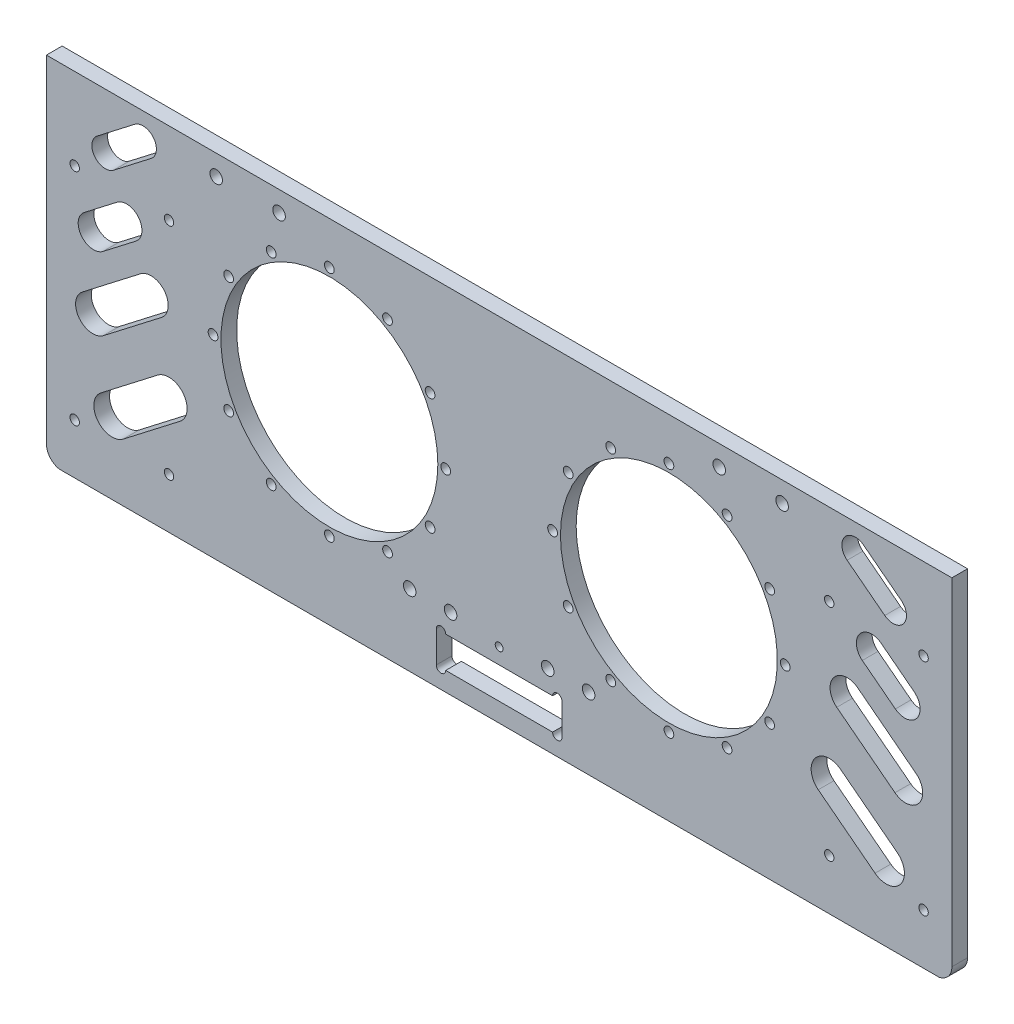
from build123d import *

# Parameters (mm, degrees)
SKETCH_1_W          = 288
SKETCH_1_H          = 101
SKETCH_1_R          = 34.5
SKETCH_1_R_2        = 1.55
EXTRUDE_1_DEPTH     = 2.5
SKETCH_2_R          = 1.5
CUT_EXTRUDE_1_DEPTH = 5
EXTRUDE_2_DEPTH     = 5
CUT_EXTRUDE_2_DEPTH = 5
CUT_EXTRUDE_3_DEPTH = 10
SKETCH_5_R          = 2
CUT_EXTRUDE_4_DEPTH = 10
SKETCH_6_R          = 1.25
CUT_EXTRUDE_5_DEPTH = 10
SKETCH_7_R          = 2
CUT_EXTRUDE_6_DEPTH = 5.5
CUT_EXTRUDE_7_DEPTH = 10
SKETCH_9_R          = 2
CUT_EXTRUDE_8_DEPTH = 10
SKETCH_10_R         = 2
CUT_EXTRUDE_9_DEPTH = 10


with BuildPart() as part:
    # 草图1 → 凸台-拉伸1 (new, symmetric)
    with BuildSketch(Plane.XY):
        Rectangle(SKETCH_1_W, SKETCH_1_H)
        with Locations((-54, 0)):
            Circle(SKETCH_1_R, mode=Mode.SUBTRACT)
        with Locations((-54, 37)):
            Circle(SKETCH_1_R_2, mode=Mode.SUBTRACT)
        with Locations((-35.5, 32.04293994)):
            Circle(SKETCH_1_R_2, mode=Mode.SUBTRACT)
        with Locations((-21.95706006, 18.5)):
            Circle(SKETCH_1_R_2, mode=Mode.SUBTRACT)
        with Locations((-17, 0)):
            Circle(SKETCH_1_R_2, mode=Mode.SUBTRACT)
        with Locations((-21.95706006, -18.5)):
            Circle(SKETCH_1_R_2, mode=Mode.SUBTRACT)
        with Locations((-35.5, -32.04293994)):
            Circle(SKETCH_1_R_2, mode=Mode.SUBTRACT)
        with Locations((-54, -37)):
            Circle(SKETCH_1_R_2, mode=Mode.SUBTRACT)
        with Locations((-72.5, -32.04293994)):
            Circle(SKETCH_1_R_2, mode=Mode.SUBTRACT)
        with Locations((-86.04293994, -18.5)):
            Circle(SKETCH_1_R_2, mode=Mode.SUBTRACT)
        with Locations((-91, 0)):
            Circle(SKETCH_1_R_2, mode=Mode.SUBTRACT)
        with Locations((-86.04293994, 18.5)):
            Circle(SKETCH_1_R_2, mode=Mode.SUBTRACT)
        with Locations((-72.5, 32.04293994)):
            Circle(SKETCH_1_R_2, mode=Mode.SUBTRACT)
        with Locations((72.5, 32.04293994)):
            Circle(SKETCH_1_R_2, mode=Mode.SUBTRACT)
        with Locations((86.04293994, 18.5)):
            Circle(SKETCH_1_R_2, mode=Mode.SUBTRACT)
        with Locations((91, 0)):
            Circle(SKETCH_1_R_2, mode=Mode.SUBTRACT)
        with Locations((86.04293994, -18.5)):
            Circle(SKETCH_1_R_2, mode=Mode.SUBTRACT)
        with Locations((72.5, -32.04293994)):
            Circle(SKETCH_1_R_2, mode=Mode.SUBTRACT)
        with Locations((54, -37)):
            Circle(SKETCH_1_R_2, mode=Mode.SUBTRACT)
        with Locations((35.5, -32.04293994)):
            Circle(SKETCH_1_R_2, mode=Mode.SUBTRACT)
        with Locations((21.95706006, -18.5)):
            Circle(SKETCH_1_R_2, mode=Mode.SUBTRACT)
        with Locations((17, 0)):
            Circle(SKETCH_1_R_2, mode=Mode.SUBTRACT)
        with Locations((21.95706006, 18.5)):
            Circle(SKETCH_1_R_2, mode=Mode.SUBTRACT)
        with Locations((35.5, 32.04293994)):
            Circle(SKETCH_1_R_2, mode=Mode.SUBTRACT)
        with Locations((54, 37)):
            Circle(SKETCH_1_R_2, mode=Mode.SUBTRACT)
        with Locations((54, 0)):
            Circle(SKETCH_1_R, mode=Mode.SUBTRACT)
    extrude(amount=EXTRUDE_1_DEPTH, both=True)

    # 草图2 → 切除-拉伸1 (cut)
    with BuildSketch(Plane.XY.offset(2.5)):
        with Locations((135, -45.5)):
            Circle(SKETCH_2_R)
        with Locations((105, -45.5)):
            Circle(SKETCH_2_R)
        with Locations((135, 24.5)):
            Circle(SKETCH_2_R)
        with Locations((105, 24.5)):
            Circle(SKETCH_2_R)
        with Locations((-105, -45.5)):
            Circle(SKETCH_2_R)
        with Locations((-135, -45.5)):
            Circle(SKETCH_2_R)
        with Locations((-105, 24.5)):
            Circle(SKETCH_2_R)
        with Locations((-135, 24.5)):
            Circle(SKETCH_2_R)
    extrude(amount=-CUT_EXTRUDE_1_DEPTH, mode=Mode.SUBTRACT)

    # 草图3 → 凸台-拉伸2 (add)
    with BuildSketch(Plane.XY.offset(2.5)):
        with BuildLine():
            Line((144, -50.5), (20, -50.5))
            Line((20, -50.5), (20, -55.5))
            ThreePointArc((20, -55.5), (18.5, -57), (17, -55.5))
            Line((17, -55.5), (-17, -55.5))
            ThreePointArc((-17, -55.5), (-18.5, -57), (-20, -55.5))
            Line((-20, -55.5), (-20, -50.5))
            Line((-20, -50.5), (-144, -50.5))
            Line((-144, -50.5), (-144, -56.593800871))
            ThreePointArc((-144, -56.593800871), (-142.857209562, -59.775299636), (-139.951226243, -61.502483855))
            Line((-139.951226243, -61.502483855), (-20.471229939, -84.655844628))
            ThreePointArc((-20.471229939, -84.655844628), (-19.997803382, -84.724280033), (-19.520003695, -84.747161644))
            Line((-19.520003695, -84.747161644), (19.521113953, -84.747161644))
            ThreePointArc((19.521113953, -84.747161644), (19.997818521, -84.724385042), (20.470180004, -84.656262746))
            Line((20.470180004, -84.656262746), (139.949066052, -61.557664392))
            ThreePointArc((139.949066052, -61.557664392), (142.856509449, -59.830910673), (144, -56.64856329))
            Line((144, -56.64856329), (144, -50.5))
        make_face()
    extrude(amount=-EXTRUDE_2_DEPTH)

    # 草图3<3> → 切除-拉伸2 (cut)
    with BuildSketch(Plane.XY.offset(2.5)):
        with BuildLine():
            Line((17, -45.5), (-17, -45.5))
            ThreePointArc((-17, -45.5), (-18.5, -44), (-20, -45.5))
            Line((-20, -45.5), (-20, -50.5))
            Line((-20, -50.5), (20, -50.5))
            Line((20, -50.5), (20, -45.5))
            ThreePointArc((20, -45.5), (18.5, -44), (17, -45.5))
        make_face()
    extrude(amount=-CUT_EXTRUDE_2_DEPTH, mode=Mode.SUBTRACT)

    # 草图4 → 切除-拉伸3 (cut)
    with BuildSketch(Plane.XY.offset(2.5)):
        Polygon((-139.951226243, -61.502483855), (139.949066052, -61.557664392), (30.752560592, -109.96050726), align=None)
    extrude(amount=-CUT_EXTRUDE_3_DEPTH, mode=Mode.SUBTRACT)

    # 草图5 → 切除-拉伸4 (cut)
    with BuildSketch(Plane.XY.offset(2.5)):
        with Locations((28.453320593, -38.713035771)):
            Circle(SKETCH_5_R)
        with Locations((-28.453320593, -38.713035771)):
            Circle(SKETCH_5_R)
    extrude(amount=-CUT_EXTRUDE_4_DEPTH, mode=Mode.SUBTRACT)

    # 草图6 → 切除-拉伸5 (cut)
    with BuildSketch(Plane.XY.offset(2.5)):
        with Locations((0, -40.5)):
            Circle(SKETCH_6_R)
    extrude(amount=-CUT_EXTRUDE_5_DEPTH, mode=Mode.SUBTRACT)

    # 草图7 → 切除-拉伸6 (cut)
    with BuildSketch(Plane.XY.offset(2.5)):
        with Locations((90, 44)):
            Circle(SKETCH_7_R)
        with Locations((70, 44)):
            Circle(SKETCH_7_R)
    extrude(amount=-CUT_EXTRUDE_6_DEPTH, mode=Mode.SUBTRACT)

    # 草图8 → 切除-拉伸7 (cut)
    with BuildSketch(Plane.XY.offset(2.5)):
        with BuildLine():
            Line((-126.028633635, 5.392144418), (-115.521536728, 13.498726459))
            ThreePointArc((-115.521536728, 13.498726459), (-114.63733934, 20.354824934), (-121.493437815, 21.239022322))
            Line((-121.493437815, 21.239022322), (-132.000534722, 13.132440281))
            ThreePointArc((-132.000534722, 13.132440281), (-132.88473211, 6.276341806), (-126.028633635, 5.392144418))
        make_face()
        with BuildLine():
            Line((-125.902226808, -17.744290693), (-107.39178991, -3.462860089))
            ThreePointArc((-107.39178991, -3.462860089), (-106.401214333, 4.218098708), (-114.082173129, 5.208674285))
            Line((-114.082173129, 5.208674285), (-132.592610027, -9.072756319))
            ThreePointArc((-132.592610027, -9.072756319), (-133.583185604, -16.753715115), (-125.902226808, -17.744290693))
        make_face()
        with BuildLine():
            Line((-119.575583656, -43.071406764), (-101.502967944, -29.127770071))
            ThreePointArc((-101.502967944, -29.127770071), (-100.453850675, -20.992876886), (-108.58874386, -19.943759617))
            Line((-108.58874386, -19.943759617), (-126.661359573, -33.88739631))
            ThreePointArc((-126.661359573, -33.88739631), (-127.710476842, -42.022289495), (-119.575583656, -43.071406764))
        make_face()
        with BuildLine():
            Line((-115.917155682, 45.475749506), (-127.890720707, 36.237737517))
            ThreePointArc((-127.890720707, 36.237737517), (-128.665660372, 30.228827371), (-122.656750226, 29.453887705))
            Line((-122.656750226, 29.453887705), (-110.683185201, 38.691899695))
            ThreePointArc((-110.683185201, 38.691899695), (-109.908245536, 44.700809841), (-115.917155682, 45.475749506))
        make_face()
        with BuildLine():
            ThreePointArc((122.656750226, 29.453887705), (128.665660372, 30.228827371), (127.890720707, 36.237737517))
            Line((127.890720707, 36.237737517), (115.917155682, 45.475749506))
            ThreePointArc((115.917155682, 45.475749506), (109.908245536, 44.700809841), (110.683185201, 38.691899695))
            Line((110.683185201, 38.691899695), (122.656750226, 29.453887705))
        make_face()
        with BuildLine():
            ThreePointArc((108.58874386, -19.943759617), (100.453850675, -20.992876886), (101.502967944, -29.127770071))
            Line((101.502967944, -29.127770071), (119.575583656, -43.071406764))
            ThreePointArc((119.575583656, -43.071406764), (127.710476842, -42.022289495), (126.661359573, -33.88739631))
            Line((126.661359573, -33.88739631), (108.58874386, -19.943759617))
        make_face()
        with BuildLine():
            ThreePointArc((114.082173129, 5.208674285), (106.401214333, 4.218098708), (107.39178991, -3.462860089))
            Line((107.39178991, -3.462860089), (125.902226808, -17.744290693))
            ThreePointArc((125.902226808, -17.744290693), (133.583185604, -16.753715115), (132.592610027, -9.072756319))
            Line((132.592610027, -9.072756319), (114.082173129, 5.208674285))
        make_face()
        with BuildLine():
            ThreePointArc((121.493437815, 21.239022322), (114.63733934, 20.354824934), (115.521536728, 13.498726459))
            Line((115.521536728, 13.498726459), (126.028633635, 5.392144418))
            ThreePointArc((126.028633635, 5.392144418), (132.88473211, 6.276341806), (132.000534722, 13.132440281))
            Line((132.000534722, 13.132440281), (121.493437815, 21.239022322))
        make_face()
    extrude(amount=-CUT_EXTRUDE_7_DEPTH, mode=Mode.SUBTRACT)

    # 草图9 → 切除-拉伸8 (cut)
    with BuildSketch(Plane.XY.offset(2.5)):
        with Locations((15.453320593, -38.713035771)):
            Circle(SKETCH_9_R)
        with Locations((-15.453320593, -38.713035771)):
            Circle(SKETCH_9_R)
    extrude(amount=-CUT_EXTRUDE_8_DEPTH, mode=Mode.SUBTRACT)

    # 草图10 → 切除-拉伸9 (cut)
    with BuildSketch(Plane.XY.offset(2.5)):
        with Locations((-70, 44)):
            Circle(SKETCH_10_R)
        with Locations((-90, 44)):
            Circle(SKETCH_10_R)
    extrude(amount=-CUT_EXTRUDE_9_DEPTH, mode=Mode.SUBTRACT)


solid = part.part
